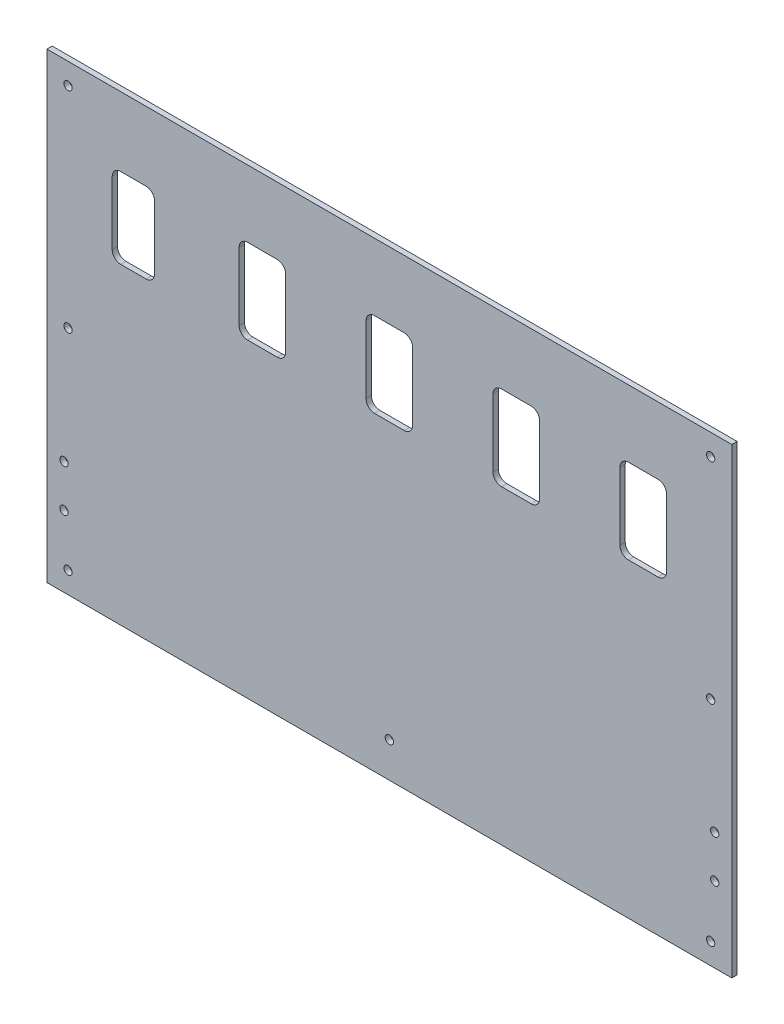
from build123d import *

# Parameters (mm, degrees)
SKETCH3_W              = 411.1625
SKETCH3_H              = 277.368
BOSS_EXTRUDE1_DEPTH    = 1.5875
CUT_EXTRUDE1_DEPTH     = 25.4
F_10_CLEARANCE_HOLE1_D = 4.9784
F_10_CLEARANCE_HOLE2_D = 4.9784
F_10_CLEARANCE_HOLE3_D = 4.9784
F_10_CLEARANCE_HOLE4_D = 4.9784
F_10_CLEARANCE_HOLE5_D = 4.9784


with BuildPart() as part:
    # Sketch3 → Boss-Extrude1 (new, symmetric)
    with BuildSketch(Plane.XY):
        Rectangle(SKETCH3_W, SKETCH3_H)
    extrude(amount=BOSS_EXTRUDE1_DEPTH, both=True)

    # Sketch4 → Cut-Extrude1 (cut)
    with BuildSketch(Plane.XY.offset(1.5875)):
        with BuildLine():
            Line((-8.89, 98.4326708), (8.89, 98.4326708))
            ThreePointArc((8.89, 98.4326708), (12.482102448, 96.944773248), (13.97, 93.3526708))
            Line((13.97, 93.3526708), (13.97, 52.7126708))
            ThreePointArc((13.97, 52.7126708), (12.482102448, 49.120568352), (8.89, 47.6326708))
            Line((8.89, 47.6326708), (-8.89, 47.6326708))
            ThreePointArc((-8.89, 47.6326708), (-12.482102448, 49.120568352), (-13.97, 52.7126708))
            Line((-13.97, 52.7126708), (-13.97, 93.3526708))
            ThreePointArc((-13.97, 93.3526708), (-12.482102448, 96.944773248), (-8.89, 98.4326708))
        make_face()
        with BuildLine():
            Line((67.31, 98.4326708), (85.09, 98.4326708))
            ThreePointArc((85.09, 98.4326708), (88.682102448, 96.944773248), (90.17, 93.3526708))
            Line((90.17, 93.3526708), (90.17, 52.7126708))
            ThreePointArc((90.17, 52.7126708), (88.682102448, 49.120568352), (85.09, 47.6326708))
            Line((85.09, 47.6326708), (67.31, 47.6326708))
            ThreePointArc((67.31, 47.6326708), (63.717897552, 49.120568352), (62.23, 52.7126708))
            Line((62.23, 52.7126708), (62.23, 93.3526708))
            ThreePointArc((62.23, 93.3526708), (63.717897552, 96.944773248), (67.31, 98.4326708))
        make_face()
        with BuildLine():
            Line((143.51, 98.4326708), (161.29, 98.4326708))
            ThreePointArc((161.29, 98.4326708), (164.882102448, 96.944773248), (166.37, 93.3526708))
            Line((166.37, 93.3526708), (166.37, 52.7126708))
            ThreePointArc((166.37, 52.7126708), (164.882102448, 49.120568352), (161.29, 47.6326708))
            Line((161.29, 47.6326708), (143.51, 47.6326708))
            ThreePointArc((143.51, 47.6326708), (139.917897552, 49.120568352), (138.43, 52.7126708))
            Line((138.43, 52.7126708), (138.43, 93.3526708))
            ThreePointArc((138.43, 93.3526708), (139.917897552, 96.944773248), (143.51, 98.4326708))
        make_face()
        with BuildLine():
            Line((-85.09, 98.4326708), (-67.31, 98.4326708))
            ThreePointArc((-67.31, 98.4326708), (-63.717897552, 96.944773248), (-62.23, 93.3526708))
            Line((-62.23, 93.3526708), (-62.23, 52.7126708))
            ThreePointArc((-62.23, 52.7126708), (-63.717897552, 49.120568352), (-67.31, 47.6326708))
            Line((-67.31, 47.6326708), (-85.09, 47.6326708))
            ThreePointArc((-85.09, 47.6326708), (-88.682102448, 49.120568352), (-90.17, 52.7126708))
            Line((-90.17, 52.7126708), (-90.17, 93.3526708))
            ThreePointArc((-90.17, 93.3526708), (-88.682102448, 96.944773248), (-85.09, 98.4326708))
        make_face()
        with BuildLine():
            Line((-161.29, 97.1626708), (-146.05, 97.1626708))
            ThreePointArc((-146.05, 97.1626708), (-142.457897552, 95.674773248), (-140.97, 92.0826708))
            Line((-140.97, 92.0826708), (-140.97, 53.9826708))
            ThreePointArc((-140.97, 53.9826708), (-142.457897552, 50.390568352), (-146.05, 48.9026708))
            Line((-146.05, 48.9026708), (-161.29, 48.9026708))
            ThreePointArc((-161.29, 48.9026708), (-164.882102448, 50.390568352), (-166.37, 53.9826708))
            Line((-166.37, 53.9826708), (-166.37, 92.0826708))
            ThreePointArc((-166.37, 92.0826708), (-164.882102448, 95.674773248), (-161.29, 97.1626708))
        make_face()
    extrude(amount=-CUT_EXTRUDE1_DEPTH, mode=Mode.SUBTRACT)

    # #10 Clearance Hole1 (through all)
    with Locations(Plane.XY.offset(1.5875)):
        with Locations((192.88125, 125.984), (-192.88125, -125.984), (192.88125, -125.984), (-192.88125, 125.984), (-192.88125, 0), (192.88125, 0)):
            Hole(F_10_CLEARANCE_HOLE1_D / 2)

    # #10 Clearance Hole2 (through all)
    with Locations(Plane.XY.offset(1.5875)):
        with Locations((0, -117.532545274)):
            Hole(F_10_CLEARANCE_HOLE2_D / 2)

    # #10 Clearance Hole3 (through all)
    with Locations(Plane.XY.offset(1.5875)):
        with Locations((-195.30625, -70.615668917)):
            Hole(F_10_CLEARANCE_HOLE3_D / 2)

    # #10 Clearance Hole4 (through all)
    with Locations(Plane.XY.offset(1.5875)):
        with Locations((-195.30625, -96.015668917)):
            Hole(F_10_CLEARANCE_HOLE4_D / 2)

    # #10 Clearance Hole5 (through all)
    with Locations(Plane.XY.offset(1.5875)):
        with Locations((195.30625, -68.024189157), (195.30625, -93.424189157)):
            Hole(F_10_CLEARANCE_HOLE5_D / 2)


solid = part.part
